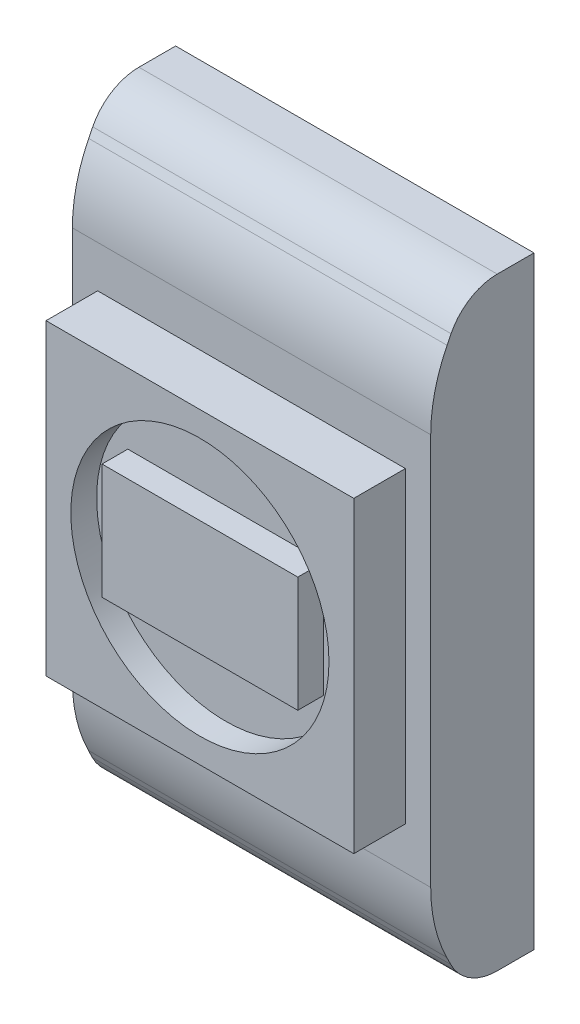
from build123d import *

# Parameters (mm, degrees)
SKETCH1_W           = 6.94
SKETCH1_H           = 9
BOSS_EXTRUDE1_DEPTH = 2
SKETCH3_W           = 6.94
SKETCH3_H           = 1.5
BOSS_EXTRUDE2_DEPTH = 1
SKETCH5_W           = 6.94
SKETCH5_H           = 1.5
BOSS_EXTRUDE3_DEPTH = 1
BOSS_EXTRUDE4_DEPTH = 6.94
FILLET4_R           = 3
FILLET5_R           = 1
FILLET6_R           = 3
FILLET7_R           = 1
SKETCH1_4_W         = 5.96
SKETCH1_4_H         = 5.96
BOSS_EXTRUDE5_DEPTH = 1
SKETCH8_R           = 2.5
CUT_EXTRUDE1_DEPTH  = 0.5
SKETCH8_3_W         = 3.79167841
SKETCH8_3_H         = 2.234967368
BOSS_EXTRUDE6_DEPTH = 0.5


with BuildPart() as part:
    # Sketch1 → Boss-Extrude1 (new body)
    with BuildSketch(Plane.XY):
        Rectangle(SKETCH1_W, SKETCH1_H)
    extrude(amount=-BOSS_EXTRUDE1_DEPTH)

    # Sketch3 → Boss-Extrude2 (add)
    with BuildSketch(Plane(origin=(0, 0.899682646, 1.799761941), x_dir=(-1, 0, 0), z_dir=(0, -0.4471347413551615, -0.8944666137275626))):
        with Locations((0, 4.775099762)):
            Rectangle(SKETCH3_W, SKETCH3_H)
    extrude(amount=BOSS_EXTRUDE2_DEPTH)

    # Sketch5 → Boss-Extrude3 (add)
    with BuildSketch(Plane(origin=(0, -0.880909966, 1.785523027), x_dir=(1, 0, 0), z_dir=(0, -0.4424452173048707, 0.8967955339340434))):
        with Locations((0, -4.785579903)):
            Rectangle(SKETCH5_W, SKETCH5_H)
    extrude(amount=-BOSS_EXTRUDE3_DEPTH)

    # Sketch7 → Boss-Extrude4 (add)
    with BuildSketch(Plane.ZY.offset(3.47)):
        Polygon((-2, 4.5), (-1.117984713, 4.5), (-1.565168726, 5.394565179), (-0.670702112, 5.841699921), (-2, 5.841699921), align=None)
        Polygon((-2, -4.5), (-1.115081378, -4.5), (-1.56046336, -5.402748084), (-0.663667826, -5.845193301), (-2, -5.845193301), align=None)
    extrude(amount=-BOSS_EXTRUDE4_DEPTH)

    # Fillet4
    fillet4_edges = [part.edges().sort_by_distance(p)[0] for p in [
        (0, -4.5, 0),
    ]]
    fillet(fillet4_edges, radius=FILLET4_R)

    # Fillet5
    fillet5_edges = [part.edges().sort_by_distance(p)[0] for p in [
        (0, -5.845193301, -0.663667826),
    ]]
    fillet(fillet5_edges, radius=FILLET5_R)

    # Fillet6
    fillet6_edges = [part.edges().sort_by_distance(p)[0] for p in [
        (0, 4.5, 0),
    ]]
    fillet(fillet6_edges, radius=FILLET6_R)

    # Fillet7
    fillet7_edges = [part.edges().sort_by_distance(p)[0] for p in [
        (0, 5.841699921, -0.670702112),
    ]]
    fillet(fillet7_edges, radius=FILLET7_R)

    # Sketch1<4> → Boss-Extrude5 (add)
    with BuildSketch(Plane.XY):
        Rectangle(SKETCH1_4_W, SKETCH1_4_H)
    extrude(amount=BOSS_EXTRUDE5_DEPTH)

    # Sketch8 → Cut-Extrude1 (cut)
    with BuildSketch(Plane.XY.offset(1)):
        Circle(SKETCH8_R)
    extrude(amount=-CUT_EXTRUDE1_DEPTH, mode=Mode.SUBTRACT)

    # Sketch8<3> → Boss-Extrude6 (add)
    with BuildSketch(Plane.XY.offset(1)):
        Rectangle(SKETCH8_3_W, SKETCH8_3_H)
    extrude(amount=-BOSS_EXTRUDE6_DEPTH)


solid = part.part
